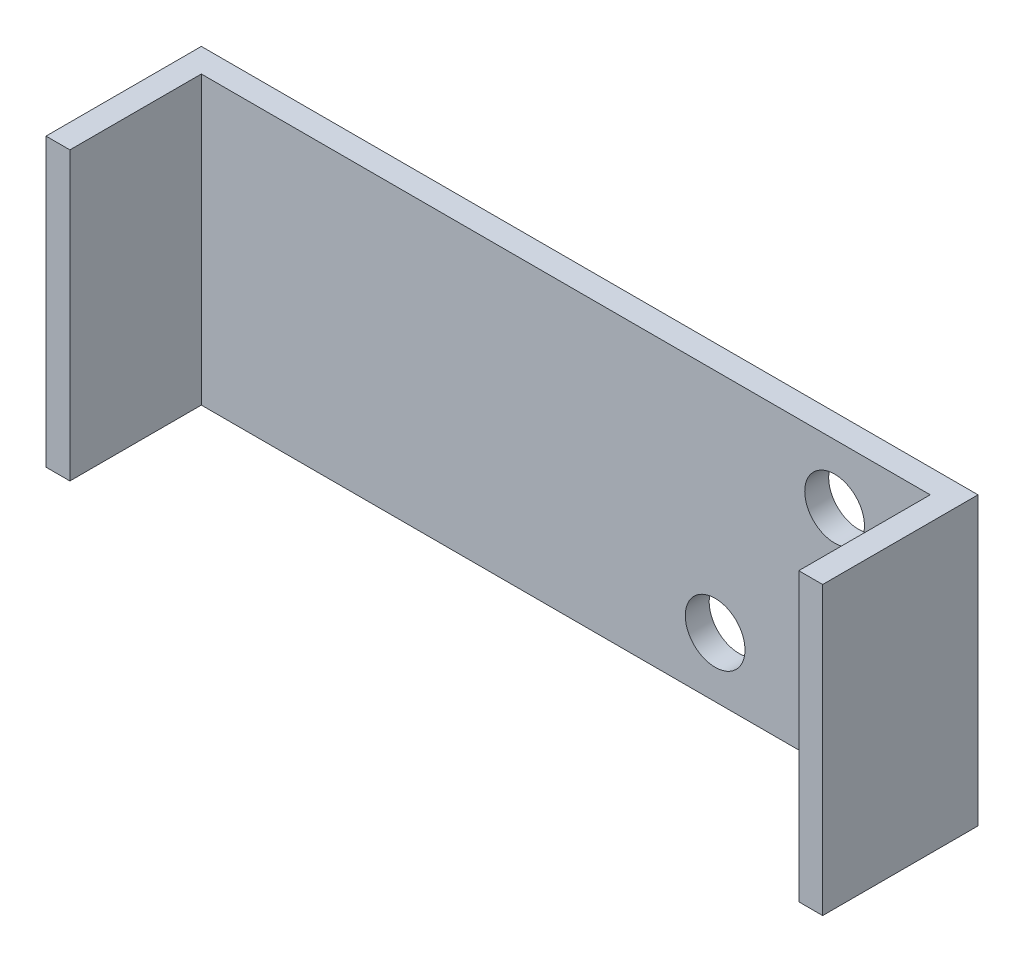
from build123d import *

# Parameters (mm, degrees)
SKETCH_1_W          = 65
SKETCH_1_H          = 24
EXTRUDE_1_DEPTH     = 13
SKETCH_2_W          = 61
SKETCH_2_H          = 24
CUT_EXTRUDE_1_DEPTH = 11
SKETCH_14_R         = 2.5
CUT_EXTRUDE_2_DEPTH = 2


with BuildPart() as part:
    # 草圖1 → 填料-伸長1 (new body)
    with BuildSketch(Plane.XY):
        with Locations((-32.5, 12)):
            Rectangle(SKETCH_1_W, SKETCH_1_H)
    extrude(amount=EXTRUDE_1_DEPTH)

    # 草圖2 → 除料-伸長1 (cut)
    with BuildSketch(Plane.XY.offset(13)):
        with Locations((-32.5, 12)):
            Rectangle(SKETCH_2_W, SKETCH_2_H)
    extrude(amount=-CUT_EXTRUDE_1_DEPTH, mode=Mode.SUBTRACT)

    # 草圖14 → 除料-伸長2 (cut)
    with BuildSketch(Plane(origin=(0, 0, 0), x_dir=(-1, 0, 0), z_dir=(0, 0, -1))):
        with Locations((10, 19)):
            Circle(SKETCH_14_R)
        with Locations((20, 5)):
            Circle(SKETCH_14_R)
    extrude(amount=-CUT_EXTRUDE_2_DEPTH, mode=Mode.SUBTRACT)


solid = part.part
